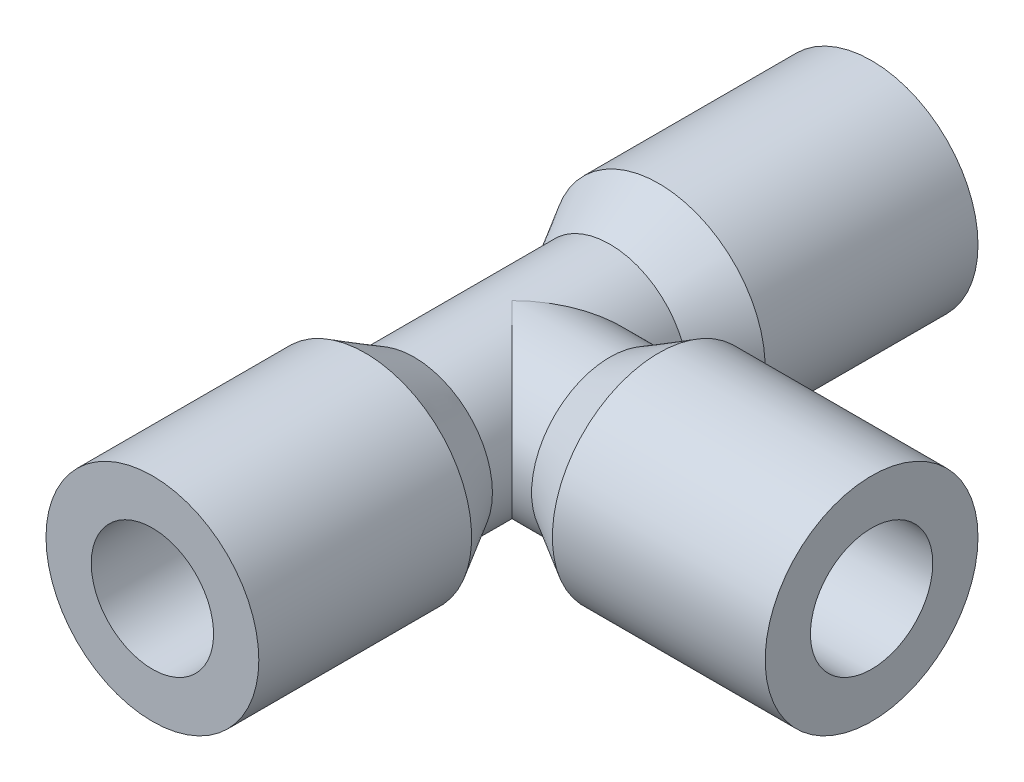
from build123d import *

# Parameters (mm, degrees)
SKETCH1_R           = 5.5245
BOSS_EXTRUDE1_DEPTH = 11.049
SKETCH2_R           = 4.064
BOSS_EXTRUDE2_DEPTH = 5.08
SKETCH3_R           = 5.5245
SKETCH4_R           = 4.064
SKETCH5_R           = 4.064
BOSS_EXTRUDE3_DEPTH = 5.08
SKETCH6_R           = 5.5245
BOSS_EXTRUDE4_DEPTH = 11.049
SKETCH7_R           = 3.175
CUT_EXTRUDE1_DEPTH  = 16.891
SKETCH9_R           = 3.175
CUT_EXTRUDE2_DEPTH  = 49.403


with BuildPart() as part:
    # Sketch1 → Boss-Extrude1 (new body)
    with BuildSketch(Plane.XY):
        Circle(SKETCH1_R)
    boss_extrude1 = extrude(amount=BOSS_EXTRUDE1_DEPTH)



with BuildPart() as body_2:
    # Sketch2 → Boss-Extrude2 (new body)
    with BuildSketch(Plane.XY.offset(13.589)):
        Circle(SKETCH2_R)
    boss_extrude2 = extrude(amount=BOSS_EXTRUDE2_DEPTH)


with BuildPart() as part_1:
    add(part.part)

    add(body_2.part)  # Loft2 merges body 2
    # Sketch3 → Loft2 section 0
    with BuildSketch(Plane.XY.offset(11.049)):
        Circle(SKETCH3_R)
    # Sketch4 → Loft2 section 1
    with BuildSketch(Plane.XY.offset(13.589)):
        Circle(SKETCH4_R)
    loft2 = loft()

    # Mirror5: Boss-Extrude1, Boss-Extrude2, Loft2 across plane
    add(boss_extrude1.mirror(Plane.XY.offset(18.669)))
    add(boss_extrude2.mirror(Plane.XY.offset(18.669)))
    add(loft2.mirror(Plane.XY.offset(18.669)))

    # Sketch5 → Boss-Extrude3 (add)
    with BuildSketch(Plane(origin=(0, 0, 0), x_dir=(0, 0, -1), z_dir=(1, 0, 0))):
        with Locations((-18.669, 0)):
            Circle(SKETCH5_R)
    extrude(amount=BOSS_EXTRUDE3_DEPTH)



with BuildPart() as body_2_2:
    # Sketch6 → Boss-Extrude4 (new body)
    with BuildSketch(Plane(origin=(7.62, 0, 0), x_dir=(0, 0, -1), z_dir=(1, 0, 0))):
        with Locations((-18.669, 0)):
            Circle(SKETCH6_R)
    extrude(amount=BOSS_EXTRUDE4_DEPTH)


with BuildPart() as part_2:
    add(part_1.part)

    add(body_2_2.part)  # loft3 joins it to this body
    # loft up to a face of the part (loft3)
    loft([Face(Wire([part_2.edges().sort_by_distance((5.08, 2.962528502, 21.450999438))[0]])), Face(Wire([part_2.edges().sort_by_distance((7.62, -4.027187182, 22.450780487))[0]]))])

    # Sketch7 → Cut-Extrude1 (cut)
    with BuildSketch(Plane(origin=(18.669, 0, 0), x_dir=(0, 0, -1), z_dir=(1, 0, 0))):
        with Locations((-18.669, 0)):
            Circle(SKETCH7_R)
    extrude(amount=-CUT_EXTRUDE1_DEPTH, mode=Mode.SUBTRACT)

    # Sketch9 → Cut-Extrude2 (cut)
    with BuildSketch(Plane(origin=(0, 0, 0), x_dir=(-1, 0, 0), z_dir=(0, 0, -1))):
        Circle(SKETCH9_R)
    extrude(amount=-CUT_EXTRUDE2_DEPTH, mode=Mode.SUBTRACT)


solid = part_2.part
